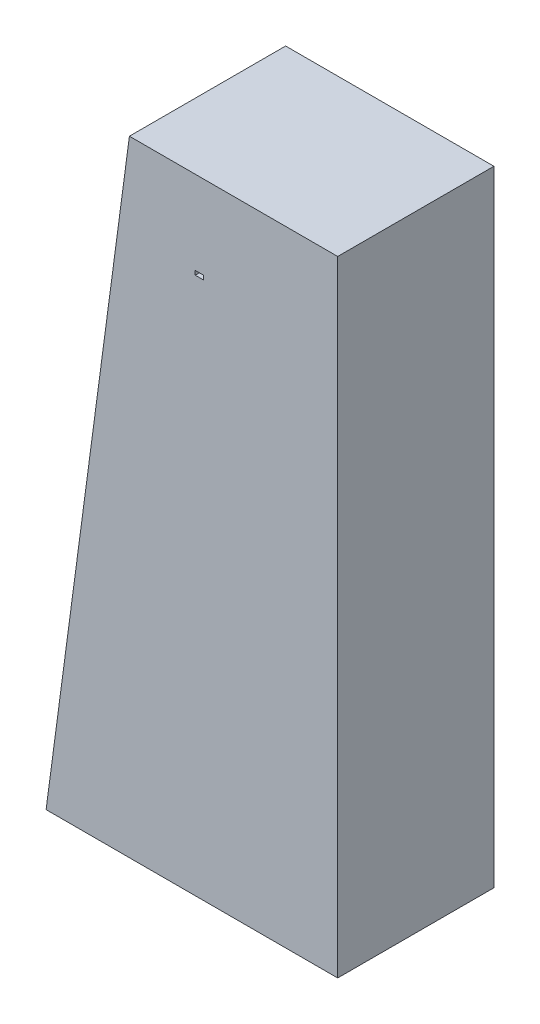
from build123d import *

# Parameters (mm, degrees)
BOSS_EXTRUDE2_DEPTH = 18.75
SKETCH2_W           = 3
SKETCH2_H           = 1
CUT_EXTRUDE1_DEPTH  = 5
SKETCH3_W           = 2
SKETCH3_H           = 1
CUT_EXTRUDE2_DEPTH  = 5


with BuildPart() as part:
    # Sketch1 → Boss-Extrude2 (new, symmetric)
    with BuildSketch(Plane.XY):
        Polygon((0, 0), (70, 0), (70, 150), (20, 150), align=None)
    extrude(amount=BOSS_EXTRUDE2_DEPTH, both=True)

    # Sketch2 → Cut-Extrude1 (cut)
    with BuildSketch(Plane(origin=(0, 0, -18.75), x_dir=(-1, 0, 0), z_dir=(0, 0, -1))):
        with Locations((-36.8, 129.5)):
            Rectangle(SKETCH2_W, SKETCH2_H)
    extrude(amount=-CUT_EXTRUDE1_DEPTH, mode=Mode.SUBTRACT)

    # Sketch3 → Cut-Extrude2 (cut)
    with BuildSketch(Plane.XY.offset(18.75)):
        with Locations((36.8, 129.5)):
            Rectangle(SKETCH3_W, SKETCH3_H)
    extrude(amount=-CUT_EXTRUDE2_DEPTH, mode=Mode.SUBTRACT)


solid = part.part
